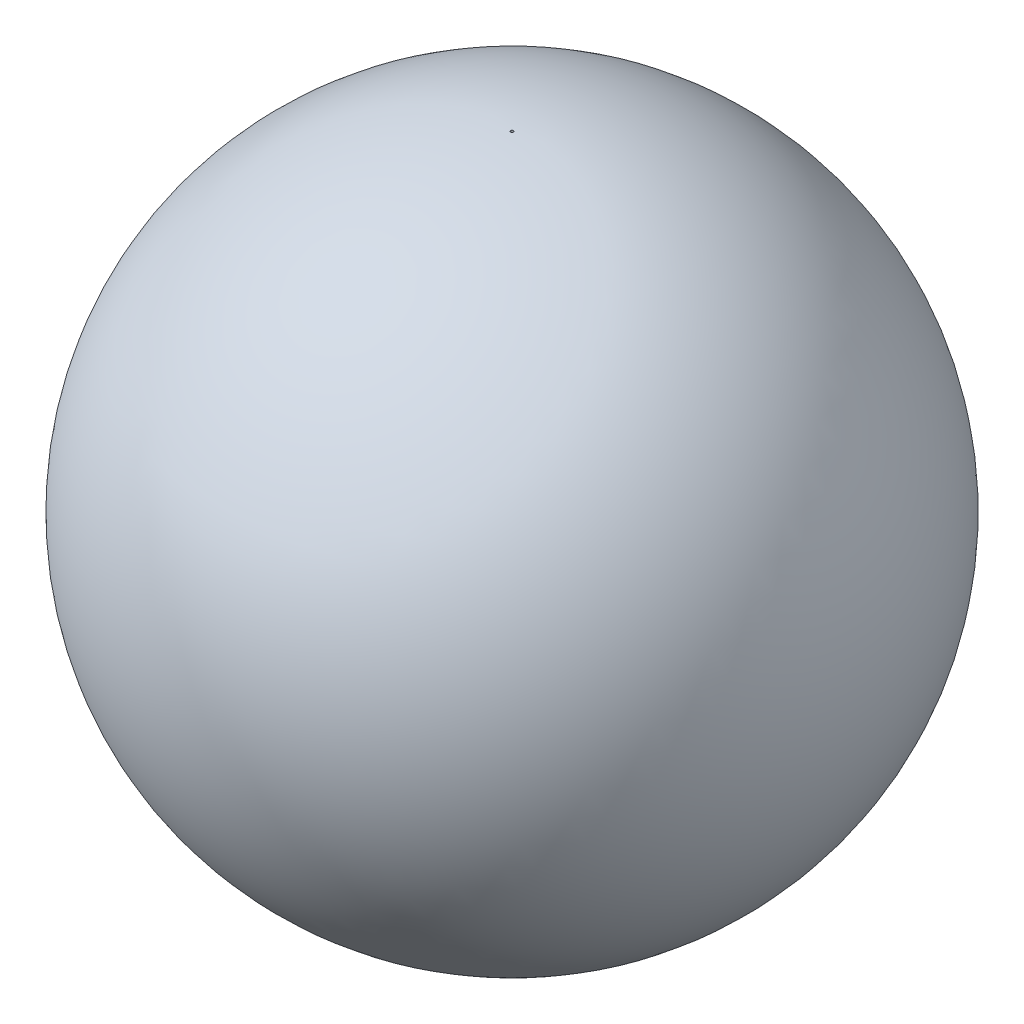
from build123d import *

# Parameters (mm, degrees)
CUT_EXTRUDE1_DEPTH      = 381.508
CUT_EXTRUDE1_DEPTH_BACK = 401.828
SKETCH2_R               = 1.27


with BuildPart() as part:
    # Sketch1 one side → Revolve3 (revolve)
    with BuildSketch(Plane(origin=(0, 0, 0), x_dir=(1, 0, 0), z_dir=(0, 1, 0))):
        with BuildLine():
            Line((0, 292.1), (0, 298.45))
            ThreePointArc((0, 298.45), (-298.45, 0), (0, -298.45))
            Line((0, -298.45), (0, -292.1))
            ThreePointArc((0, -292.1), (-292.1, 0), (0, 292.1))
        make_face()
    revolve(axis=Axis((0, 0, 0), (0, 0, 1)))

    # Sketch2 → Cut-Extrude1 (cut, two sides: drawn at the far end of the back side and taken through both)
    with BuildSketch(Plane(origin=(0, 0, 0), x_dir=(1, 0, 0), z_dir=(0, 1, 0)).offset(-CUT_EXTRUDE1_DEPTH_BACK)):
        with Locations(Location((0, 0, 0), (0, 0, 90))):
            Circle(SKETCH2_R)
    extrude(amount=CUT_EXTRUDE1_DEPTH + CUT_EXTRUDE1_DEPTH_BACK, mode=Mode.SUBTRACT)


solid = part.part
